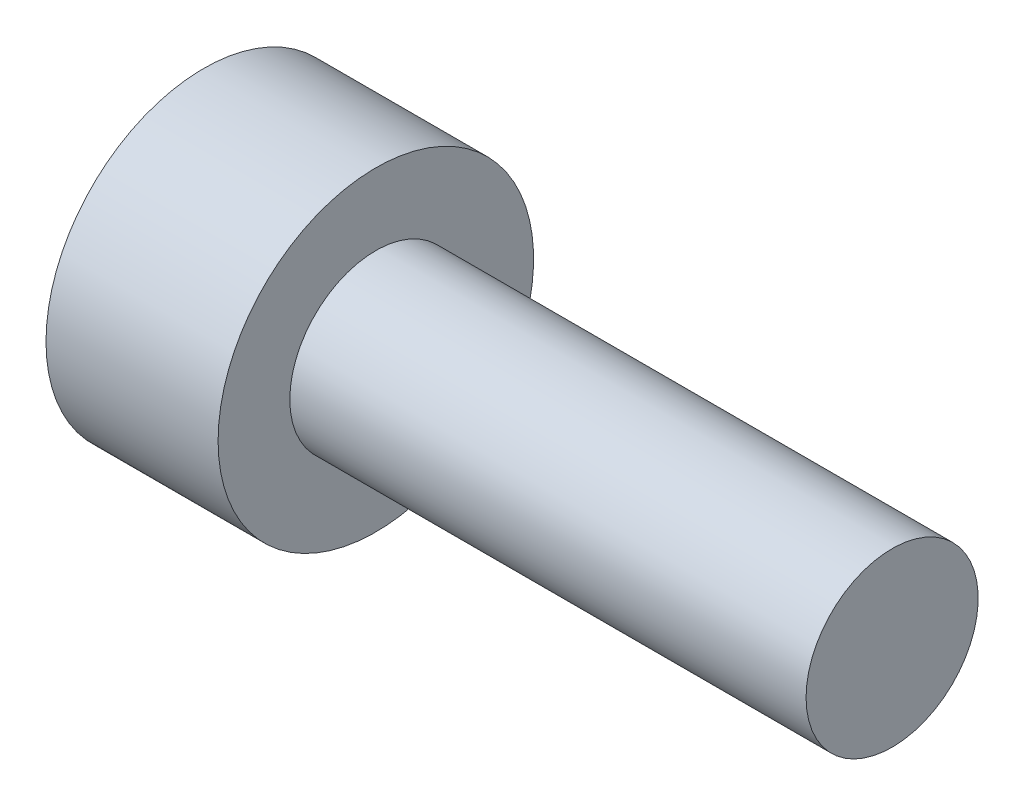
from build123d import *


with BuildPart() as part:
    # Axial profile (mm) → Full revolution (revolve)
    with BuildSketch(Plane.XY, mode=Mode.PRIVATE) as full_revolution_sk:
        Polygon((-133, 0), (-121, 0), (-121, 1.5), (-130, 1.5), (-130, 2.75), (-133, 2.75), align=None)
    revolve(full_revolution_sk.sketch.rotate(Axis((-110, 0, 0), (1, 0, 0)), 90), axis=Axis((-110, 0, 0), (1, 0, 0)))


solid = part.part
